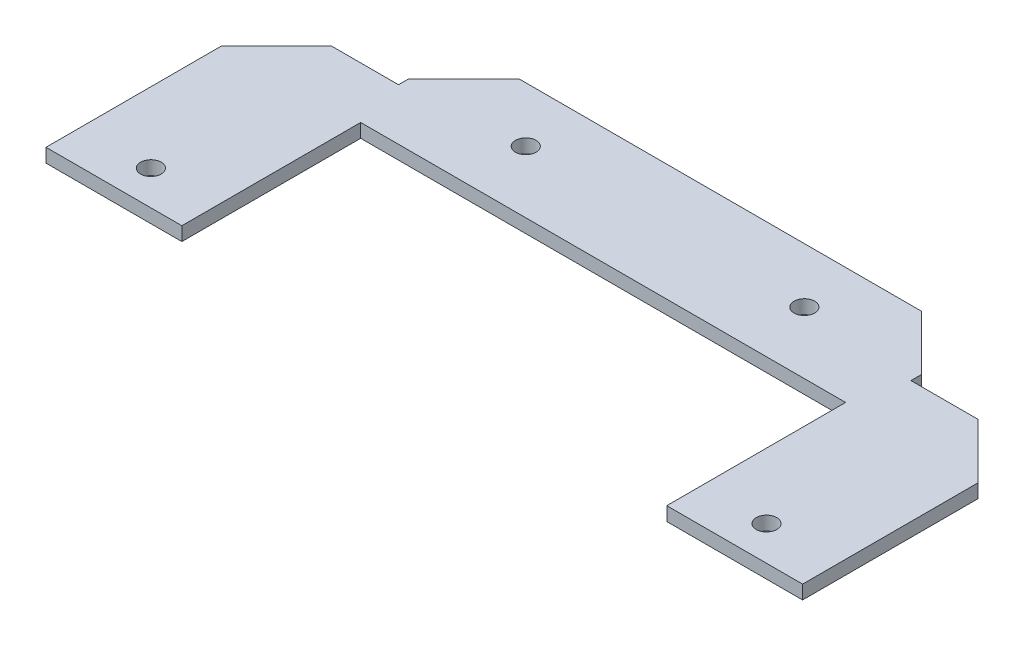
from build123d import *

# Parameters (mm, degrees)
SKETCH1_R           = 1.5
BOSS_EXTRUDE1_DEPTH = 2


with BuildPart() as part:
    # Sketch1 → Boss-Extrude1 (new body)
    with BuildSketch(Plane(origin=(0, 0, 0), x_dir=(1, 0, 0), z_dir=(0, 1, 0))):
        Polygon((0, 0), (19.75, 0), (19.75, 26), (90.25, 26), (90.25, 0), (110, 0), (110, 25.5), (102, 33.5), (92.25, 33.5), (92.25, 35), (84.25, 43), (25.75, 43), (17.75, 35), (17.75, 33.5), (8, 33.5), (0, 25.5), align=None)
        with Locations(Location((10.25, 5, 0), (0, 0, 270))):
            Circle(SKETCH1_R, mode=Mode.SUBTRACT)
        with Locations(Location((34.75, 35, 0), (0, 0, 270))):
            Circle(SKETCH1_R, mode=Mode.SUBTRACT)
        with Locations(Location((75.25, 35, 0), (0, 0, 90))):
            Circle(SKETCH1_R, mode=Mode.SUBTRACT)
        with Locations(Location((99.75, 5, 0), (0, 0, 90))):
            Circle(SKETCH1_R, mode=Mode.SUBTRACT)
    extrude(amount=BOSS_EXTRUDE1_DEPTH)


solid = part.part
